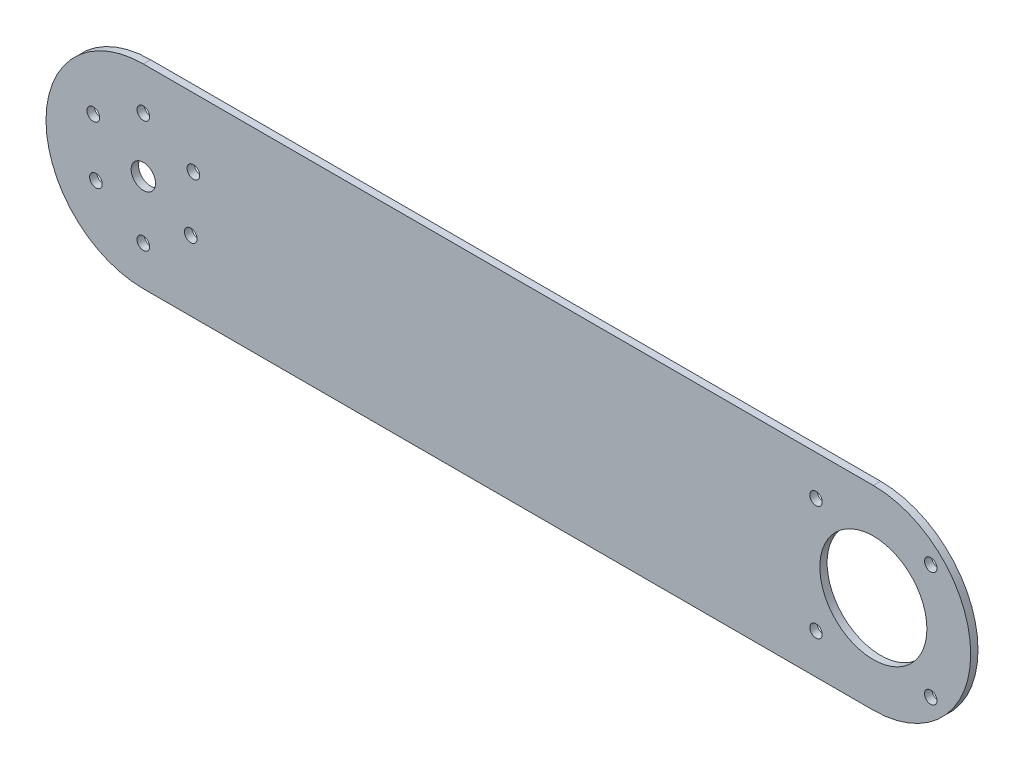
from build123d import *

# Parameters (mm, degrees)
SKETCH_1_R      = 2.6
SKETCH_1_R_2    = 5
SKETCH_1_R_3    = 22
SKETCH_1_R_4    = 2.55
EXTRUDE_1_DEPTH = 3


with BuildPart() as part:
    # 草图1 → 凸台-拉伸1 (new body)
    with BuildSketch(Plane.XY):
        with BuildLine():
            Line((-3.823548363, 44.643956065), (296.176451637, 44.643956065))
            ThreePointArc((296.176451637, 44.643956065), (336.176451637, 4.643956065), (296.176451637, -35.356043935))
            Line((296.176451637, -35.356043935), (-3.823548363, -35.356043935))
            ThreePointArc((-3.823548363, -35.356043935), (-43.823548363, 4.643956065), (-3.823548363, 44.643956065))
        make_face()
        with Locations((-3.823548363, -19.106043935)):
            Circle(SKETCH_1_R, mode=Mode.SUBTRACT)
        with Locations((15.662023222, -6.606043935)):
            Circle(SKETCH_1_R, mode=Mode.SUBTRACT)
        with Locations((-3.823548363, 4.643956065)):
            Circle(SKETCH_1_R_2, mode=Mode.SUBTRACT)
        with Locations((296.176451637, 4.643956065)):
            Circle(SKETCH_1_R_3, mode=Mode.SUBTRACT)
        with Locations((272.606451637, 28.213956065)):
            Circle(SKETCH_1_R_4, mode=Mode.SUBTRACT)
        with Locations((319.746451637, 28.213956065)):
            Circle(SKETCH_1_R_4, mode=Mode.SUBTRACT)
        with Locations((319.746451637, -18.926043935)):
            Circle(SKETCH_1_R_4, mode=Mode.SUBTRACT)
        with Locations((272.606451637, -18.926043935)):
            Circle(SKETCH_1_R_4, mode=Mode.SUBTRACT)
        with Locations((-24.391651703, 16.518956065)):
            Circle(SKETCH_1_R, mode=Mode.SUBTRACT)
        with Locations((16.744554977, 16.518956065)):
            Circle(SKETCH_1_R, mode=Mode.SUBTRACT)
        with Locations((-23.309119948, -6.606043935)):
            Circle(SKETCH_1_R, mode=Mode.SUBTRACT)
        with Locations((-3.823548363, 27.143956065)):
            Circle(SKETCH_1_R, mode=Mode.SUBTRACT)
    extrude(amount=EXTRUDE_1_DEPTH)


solid = part.part
